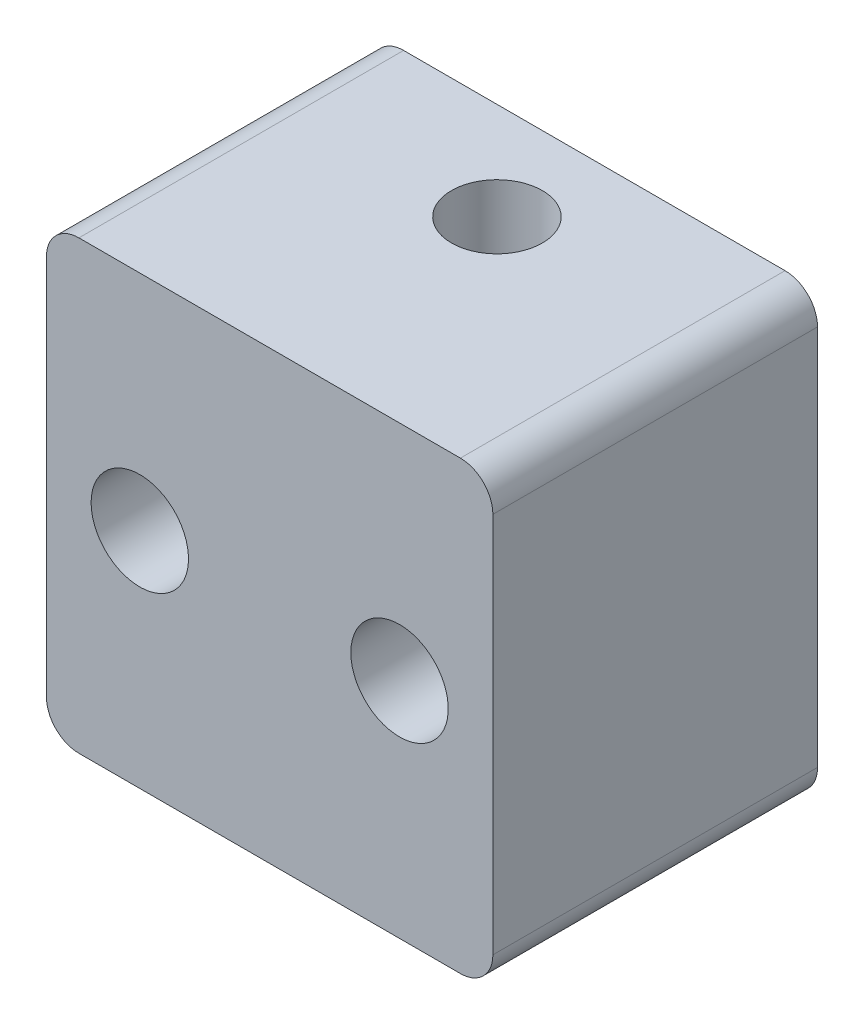
from build123d import *

# Parameters (mm, degrees)
SKETCH1_W           = 13.75
SKETCH1_H           = 13.75
BOSS_EXTRUDE1_DEPTH = 10
SKETCH3_R           = 1.4
CUT_EXTRUDE1_DEPTH  = 19.339250939
SKETCH2_R           = 1.5
CUT_EXTRUDE2_DEPTH  = 14.947446003
FILLET1_R           = 1


with BuildPart() as part:
    # Sketch1 → Boss-Extrude1 (new body)
    with BuildSketch(Plane.XY):
        Rectangle(SKETCH1_W, SKETCH1_H)
    extrude(amount=BOSS_EXTRUDE1_DEPTH)

    # Sketch3 → Cut-Extrude1 (cut, through all)
    with BuildSketch(Plane(origin=(0, 6.875, 0), x_dir=(1, 0, 0), z_dir=(0, 1, 0))):
        with Locations(Location((0, -3, 0), (0, 0, 270))):
            Circle(SKETCH3_R)
    extrude(amount=-CUT_EXTRUDE1_DEPTH, mode=Mode.SUBTRACT)

    # Sketch2 → Cut-Extrude2 (cut, through all)
    with BuildSketch(Plane(origin=(0, 0, 0), x_dir=(-1, 0, 0), z_dir=(0, 0, -1))):
        with Locations((4, 0)):
            Circle(SKETCH2_R)
        with Locations((-4, 0)):
            Circle(SKETCH2_R)
    extrude(amount=-CUT_EXTRUDE2_DEPTH, mode=Mode.SUBTRACT)

    # Fillet1
    fillet1_edges = [part.edges().sort_by_distance(p)[0] for p in [
        (-6.875, 6.875, 5),
        (-6.875, -6.875, 5),
        (6.875, -6.875, 5),
        (6.875, 6.875, 5),
    ]]
    fillet(fillet1_edges, radius=FILLET1_R)


solid = part.part
